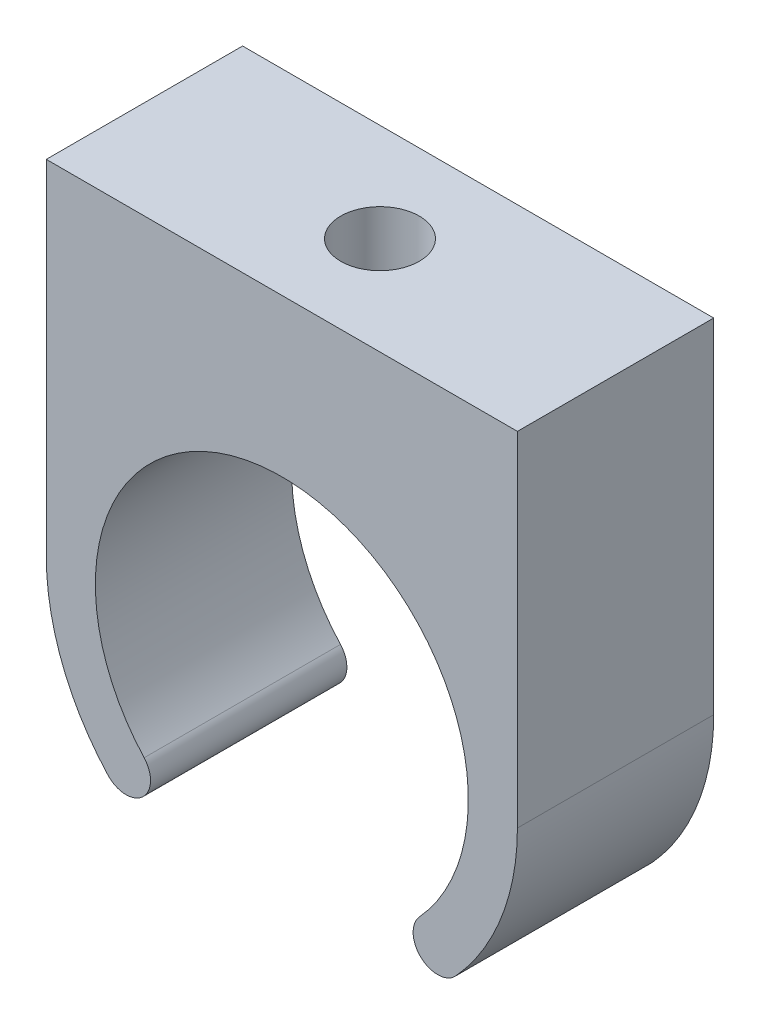
from build123d import *

# Parameters (mm, degrees)
BOSS_EXTRUDE2_DEPTH = 5
SKETCH5_R           = 2
CUT_EXTRUDE1_DEPTH  = 9
CUT_EXTRUDE2_DEPTH  = 8


with BuildPart() as part:
    # Sketch3 → Boss-Extrude2 (new, symmetric)
    with BuildSketch(Plane.XY):
        with BuildLine():
            Line((-12, -4.5), (-12, 13))
            Line((-12, 13), (12, 13))
            Line((12, 13), (12, -4.5))
            ThreePointArc((12, -4.5), (11.187544084, -8.840375258), (8.860190437, -12.593023256))
            ThreePointArc((8.860190437, -12.593023256), (7.094230677, -12.672936504), (7.014317429, -10.906976744))
            ThreePointArc((7.014317429, -10.906976744), (0, 5), (-7.014317429, -10.906976744))
            ThreePointArc((-7.014317429, -10.906976744), (-7.094230677, -12.672936504), (-8.860190437, -12.593023256))
            ThreePointArc((-8.860190437, -12.593023256), (-11.187544084, -8.840375258), (-12, -4.5))
        make_face()
    extrude(amount=BOSS_EXTRUDE2_DEPTH, both=True)

    # Sketch5 → Cut-Extrude1 (cut)
    with BuildSketch(Plane(origin=(0, 13, 0), x_dir=(1, 0, 0), z_dir=(0, 1, 0))):
        with Locations(Location((0, 0, 0), (0, 0, 270))):
            Circle(SKETCH5_R)
    extrude(amount=-CUT_EXTRUDE1_DEPTH, mode=Mode.SUBTRACT)

    # Sketch7 → Cut-Extrude2 (cut)
    with BuildSketch(Plane(origin=(0, 0, -5), x_dir=(-1, 0, 0), z_dir=(0, 0, -1))):
        with BuildLine():
            Line((10, 11.190527755), (10, 1.190527755))
            ThreePointArc((10, 1.190527755), (8.535533906, 4.726061661), (5, 6.190527755))
            Line((5, 6.190527755), (5, 11.190527755))
            Line((5, 11.190527755), (10, 11.190527755))
        make_face()
        with BuildLine():
            Line((-10, 11.190527755), (-10, 1.190527755))
            ThreePointArc((-10, 1.190527755), (-8.535533906, 4.726061661), (-5, 6.190527755))
            Line((-5, 6.190527755), (-5, 11.190527755))
            Line((-5, 11.190527755), (-10, 11.190527755))
        make_face()
    extrude(amount=-CUT_EXTRUDE2_DEPTH, mode=Mode.SUBTRACT)


solid = part.part
